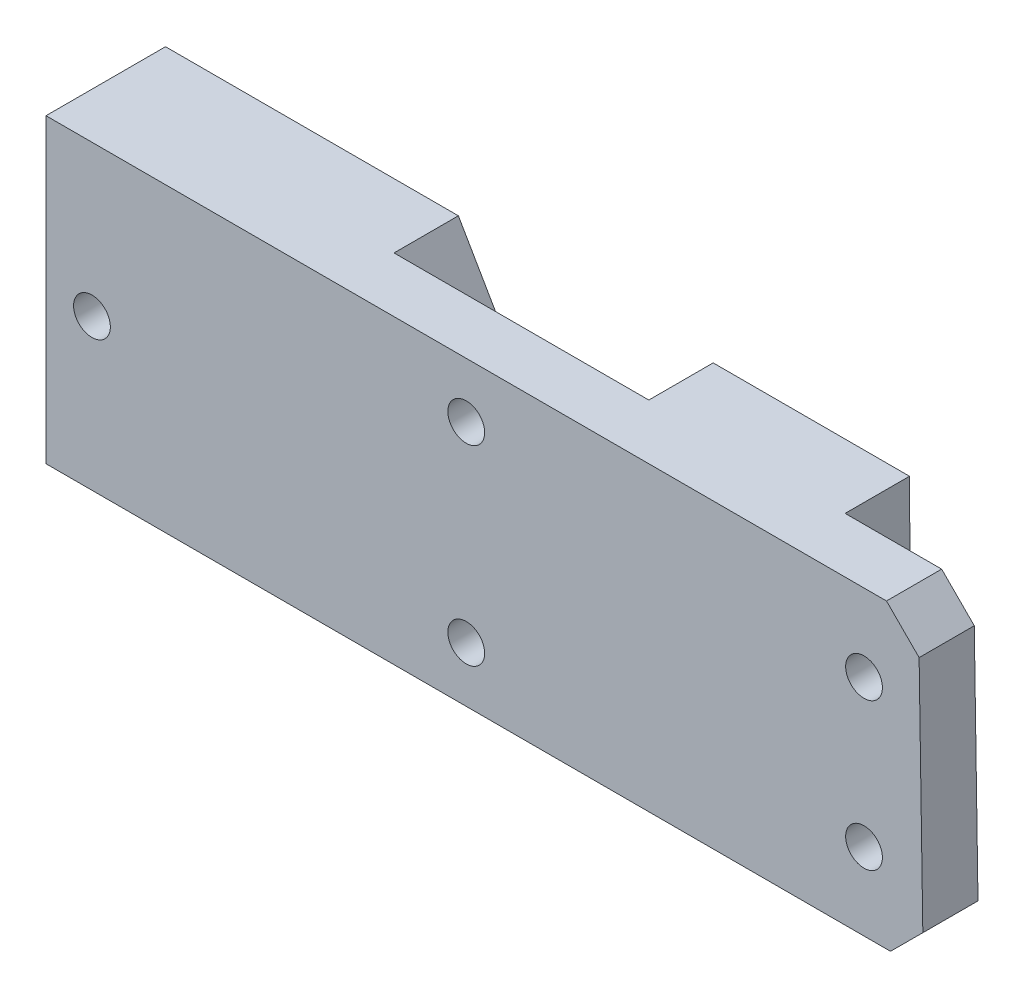
from build123d import *

# Parameters (mm, degrees)
BOSS_EXTRUDE1_DEPTH = 6
BOSS_EXTRUDE2_DEPTH = 7
CUT_EXTRUDE1_REACH  = 143.419
SKETCH3_R           = 2
CUT_EXTRUDE2_START  = -13
CUT_EXTRUDE2_DEPTH  = 7
CUT_EXTRUDE3_REACH  = 142.994
SKETCH5_R           = 2


with BuildPart() as part:
    # Sketch1 → Boss-Extrude1 (new body)
    with BuildSketch(Plane.XY):
        Polygon((44.15, 19.080039823), (135.5692396, 19.080039823), (139.116658887, 15.519822908), (139.521129618, -10.195951693), (135.999179687, -13.705241552), (44.15, -13.705241552), align=None)
    extrude(amount=BOSS_EXTRUDE1_DEPTH)

    # Sketch2 → Boss-Extrude2 (add)
    with BuildSketch(Plane(origin=(0, 0, 0), x_dir=(-1, 0, 0), z_dir=(0, 0, -1))):
        Polygon((-125.069457212, 19.080039823), (-125.284105894, -13.705241552), (-44.15, -13.705241552), (-54.15, -3.705241552), (-54.15, 9.080039823), (-44.15, 19.080039823), align=None)
    extrude(amount=BOSS_EXTRUDE2_DEPTH)

    # Sketch3 → Cut-Extrude1 (cut, up to next)
    with BuildSketch(Plane(origin=(0, 0, -7), x_dir=(-1, 0, 0), z_dir=(0, 0, -1)), mode=Mode.PRIVATE) as cut_extrude1_sk1:
        with Locations((-133.124576169, 10.687399136)):
            Circle(SKETCH3_R)
    cut_extrude1_tool1 = extrude(cut_extrude1_sk1.sketch, amount=-CUT_EXTRUDE1_REACH, mode=Mode.PRIVATE) & part.part
    # Sketch3 → Cut-Extrude1 (cut, up to next)
    with BuildSketch(Plane(origin=(0, 0, -7), x_dir=(-1, 0, 0), z_dir=(0, 0, -1)), mode=Mode.PRIVATE) as cut_extrude1_sk2:
        with Locations((-133.124576169, -5.312600864)):
            Circle(SKETCH3_R)
    cut_extrude1_tool2 = extrude(cut_extrude1_sk2.sketch, amount=-CUT_EXTRUDE1_REACH, mode=Mode.PRIVATE) & part.part
    # Sketch3 → Cut-Extrude1 (cut, up to next)
    with BuildSketch(Plane(origin=(0, 0, -7), x_dir=(-1, 0, 0), z_dir=(0, 0, -1)), mode=Mode.PRIVATE) as cut_extrude1_sk3:
        with Locations((-49.15, 2.687399136)):
            Circle(SKETCH3_R)
    cut_extrude1_tool3 = extrude(cut_extrude1_sk3.sketch, amount=-CUT_EXTRUDE1_REACH, mode=Mode.PRIVATE) & part.part
    add(cut_extrude1_tool1.solids().sort_by_distance((133.124576, 10.687399, -7))[0], mode=Mode.SUBTRACT)
    add(cut_extrude1_tool2.solids().sort_by_distance((133.124576, -5.312601, -7))[0], mode=Mode.SUBTRACT)
    add(cut_extrude1_tool3.solids().sort_by_distance((49.15, 2.687399, -7))[0], mode=Mode.SUBTRACT)

    # Sketch4 → Cut-Extrude2 (cut)
    with BuildSketch(Plane.XY.offset(6).offset(CUT_EXTRUDE2_START)):
        Polygon((76.218183383, -13.705241552), (83.146386613, -25.705241552), (97.002793074, -25.705241552), (103.930996304, -13.705241552), (97.002793074, -1.705241552), (83.146386613, -1.705241552), align=None)
        Polygon((76.003213339, 19.080039823), (82.93141657, 7.080039823), (96.78782303, 7.080039823), (103.71602626, 19.080039823), (96.78782303, 31.080039823), (82.93141657, 31.080039823), align=None)
    extrude(amount=CUT_EXTRUDE2_DEPTH, mode=Mode.SUBTRACT)

    # Sketch5 → Cut-Extrude3 (cut, up to next)
    with BuildSketch(Plane(origin=(0, 0, 0), x_dir=(-1, 0, 0), z_dir=(0, 0, -1)), mode=Mode.PRIVATE) as cut_extrude3_sk1:
        with Locations((-89.8596198, 13.080039823)):
            Circle(SKETCH5_R)
    cut_extrude3_tool1 = extrude(cut_extrude3_sk1.sketch, amount=-CUT_EXTRUDE3_REACH, mode=Mode.PRIVATE) & part.part
    # Sketch5 → Cut-Extrude3 (cut, up to next)
    with BuildSketch(Plane(origin=(0, 0, 0), x_dir=(-1, 0, 0), z_dir=(0, 0, -1)), mode=Mode.PRIVATE) as cut_extrude3_sk2:
        with Locations((-89.8596198, -7.705241552)):
            Circle(SKETCH5_R)
    cut_extrude3_tool2 = extrude(cut_extrude3_sk2.sketch, amount=-CUT_EXTRUDE3_REACH, mode=Mode.PRIVATE) & part.part
    add(cut_extrude3_tool1.solids().sort_by_distance((89.85962, 13.08004, 0))[0], mode=Mode.SUBTRACT)
    add(cut_extrude3_tool2.solids().sort_by_distance((89.85962, -7.705242, 0))[0], mode=Mode.SUBTRACT)


solid = part.part
